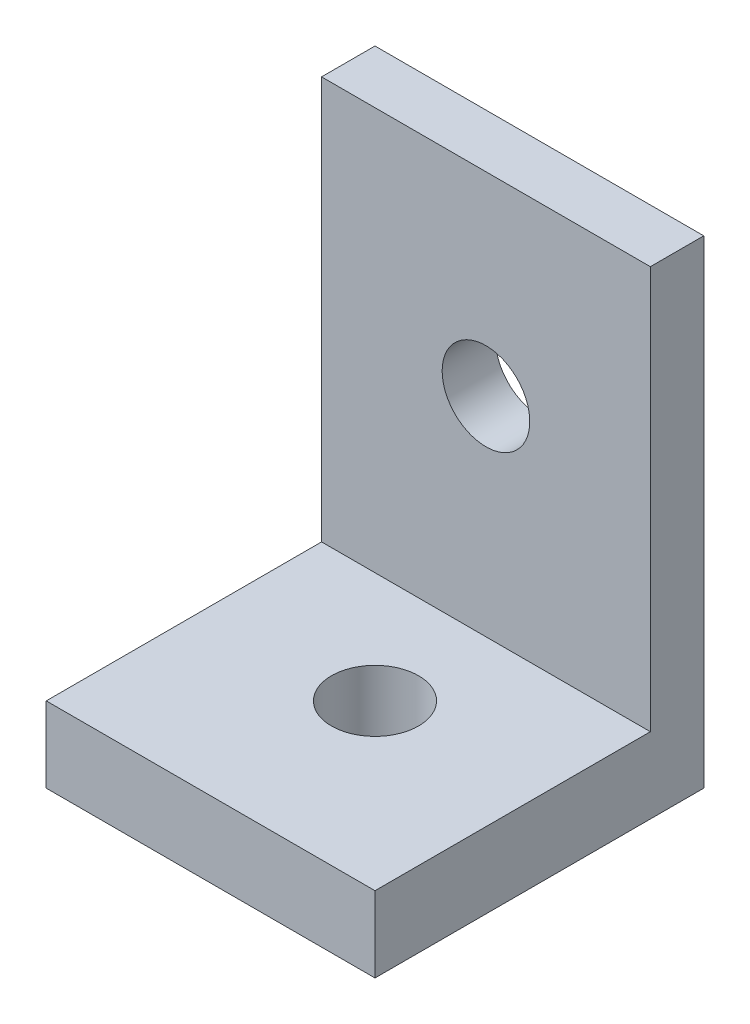
from build123d import *

# Parameters (mm, degrees)
SKETCH1_W           = 20
SKETCH1_H           = 20
SKETCH1_R           = 2.65
BOSS_EXTRUDE1_DEPTH = 4.6
SKETCH2_W           = 20
SKETCH2_H           = 3.25
BOSS_EXTRUDE2_DEPTH = 24.5
SKETCH3_R           = 2.665
CUT_EXTRUDE1_DEPTH  = 37.698910066


with BuildPart() as part:
    # Sketch1 → Boss-Extrude1 (new body)
    with BuildSketch(Plane(origin=(0, 0, 0), x_dir=(1, 0, 0), z_dir=(0, 1, 0))):
        Rectangle(SKETCH1_W, SKETCH1_H)
        with Locations(Location((0, 0, 0), (0, 0, 270))):
            Circle(SKETCH1_R, mode=Mode.SUBTRACT)
    extrude(amount=BOSS_EXTRUDE1_DEPTH)

    # Sketch2 → Boss-Extrude2 (add)
    with BuildSketch(Plane(origin=(0, 4.6, 0), x_dir=(1, 0, 0), z_dir=(0, 1, 0))):
        with Locations((0, 8.375)):
            Rectangle(SKETCH2_W, SKETCH2_H)
    extrude(amount=BOSS_EXTRUDE2_DEPTH)

    # Sketch3 → Cut-Extrude1 (cut, through all)
    with BuildSketch(Plane(origin=(0, 0, -10), x_dir=(-1, 0, 0), z_dir=(0, 0, -1))):
        with Locations((0, 17.275)):
            Circle(SKETCH3_R)
    extrude(amount=-CUT_EXTRUDE1_DEPTH, mode=Mode.SUBTRACT)


solid = part.part
